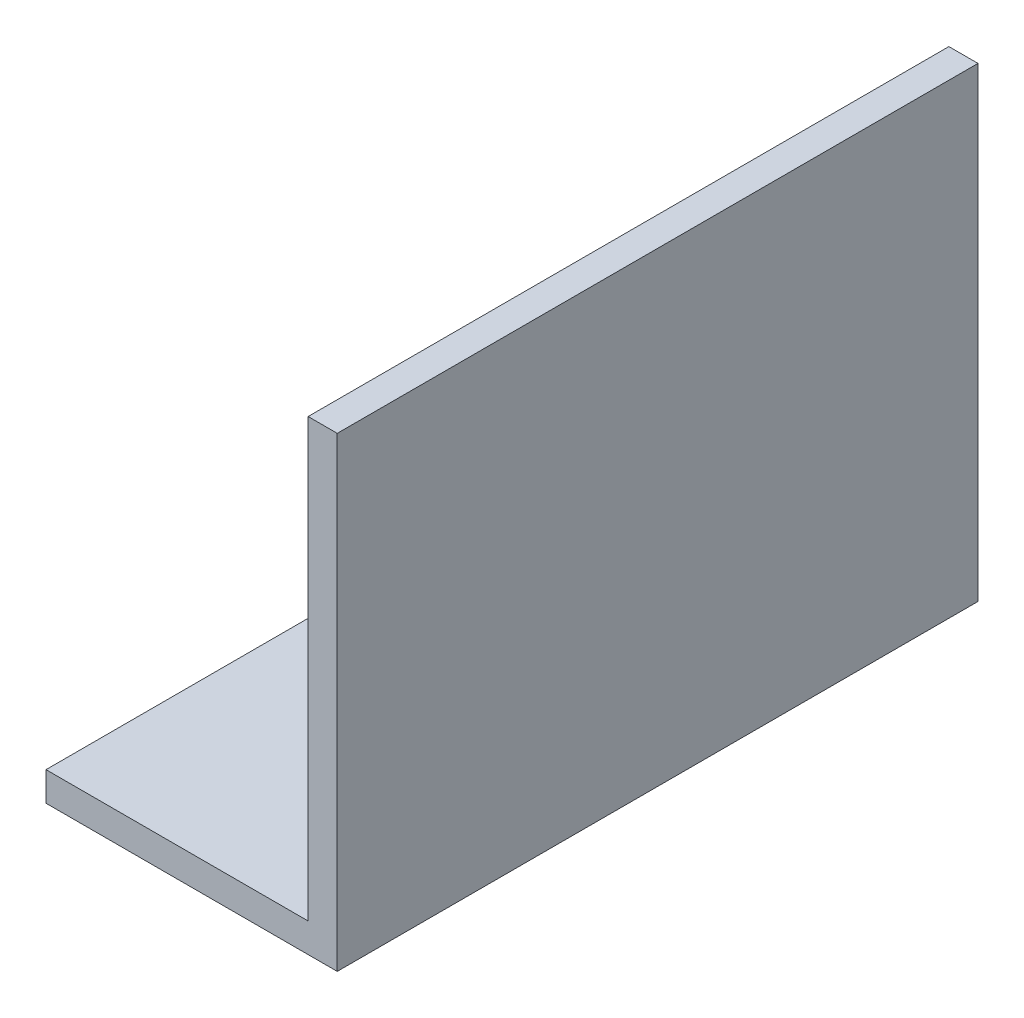
from build123d import *

# Parameters (mm, degrees)
BOSS_EXTRUDE1_DEPTH = 110


with BuildPart() as part:
    # Sketch1 → Boss-Extrude1 (new body)
    with BuildSketch(Plane.XY):
        Polygon((0, 0), (0, -80), (-50, -80), (-50, -75), (-5, -75), (-5, 0), align=None)
    extrude(amount=BOSS_EXTRUDE1_DEPTH)


solid = part.part
